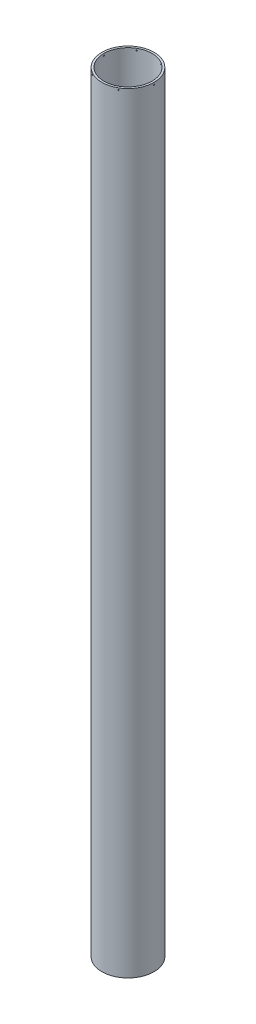
from build123d import *

# Parameters (mm, degrees)
SKETCH1_R           = 82.55
SKETCH1_R_2         = 76.2
BOSS_EXTRUDE1_DEPTH = 1219.2
SKETCH2_R           = 1.5875
CUT_EXTRUDE1_DEPTH  = 1225.77656942
CIRPATTERN1_COUNT   = 6


with BuildPart() as part:
    # Sketch1 → Boss-Extrude1 (new, symmetric)
    with BuildSketch(Plane(origin=(0, 0, 0), x_dir=(1, 0, 0), z_dir=(0, 1, 0))):
        with Locations(Location((0, 0, 0), (0, 0, 270))):
            Circle(SKETCH1_R)
        with Locations(Location((0, 0, 0), (0, 0, 270))):
            Circle(SKETCH1_R_2, mode=Mode.SUBTRACT)
    extrude(amount=BOSS_EXTRUDE1_DEPTH, both=True)

    # Sketch2 → Cut-Extrude1 (cut, through all)
    with BuildSketch(Plane(origin=(0, 0, 0), x_dir=(0, 0, -1), z_dir=(1, 0, 0))):
        with Locations((0, 1212.85)):
            Circle(SKETCH2_R)
    cut_extrude1 = extrude(amount=-CUT_EXTRUDE1_DEPTH, mode=Mode.SUBTRACT)

    # CirPattern1: Cut-Extrude1 ×6 about axis
    cirpattern1_axis = Axis((0, 1219.2, 0), (0, 1, 0))
    for i in range(1, CIRPATTERN1_COUNT):
        add(cut_extrude1.rotate(cirpattern1_axis, i * 360 / CIRPATTERN1_COUNT), mode=Mode.SUBTRACT)


solid = part.part
